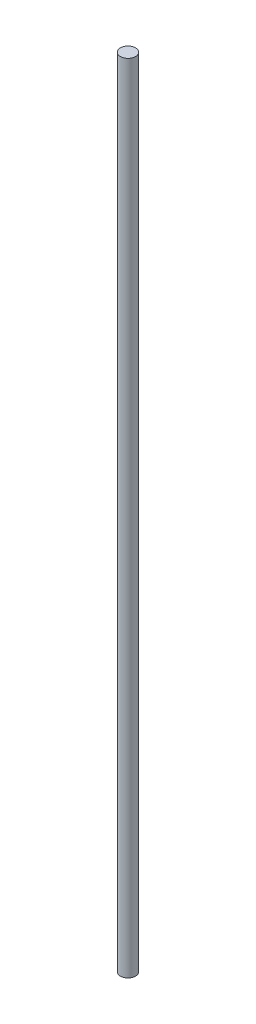
from build123d import *

# Parameters (mm, degrees)
SKETCH_1_R      = 3
EXTRUDE_1_DEPTH = 315


with BuildPart() as part:
    # 草图1 → 凸台-拉伸1 (new body)
    with BuildSketch(Plane(origin=(0, 0, 0), x_dir=(1, 0, 0), z_dir=(0, 1, 0))):
        with Locations(Location((0, 0, 0), (0, 0, 270))):
            Circle(SKETCH_1_R)
    extrude(amount=EXTRUDE_1_DEPTH)


solid = part.part
